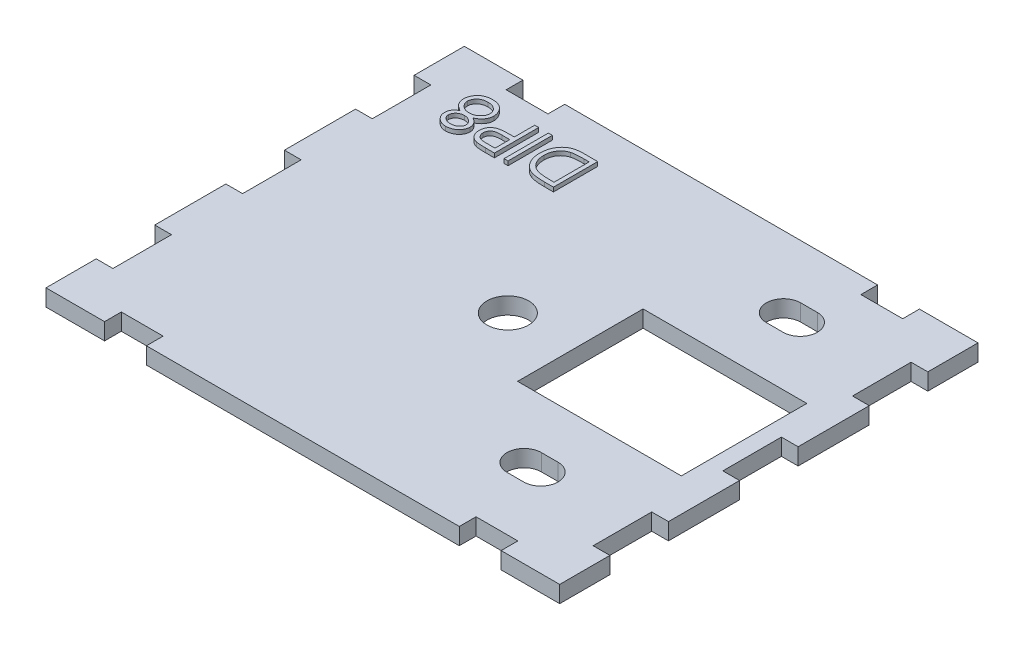
from build123d import *

# Parameters (mm, degrees)
SKETCH2_W           = 100
SKETCH2_H           = 50
BOSS_EXTRUDE1_DEPTH = 2
SKETCH12_W          = 9.8
SKETCH12_H          = 50
SKETCH12_W_2        = 8.8
CUT_EXTRUDE8_DEPTH  = 6
SKETCH13_W          = 2
SKETCH13_H          = 7
SKETCH13_W_2        = 5
SKETCH13_H_2        = 2
CUT_EXTRUDE10_DEPTH = 6
SKETCH15_W          = 6.543059906
SKETCH15_H          = 1
CUT_EXTRUDE13_DEPTH = 10
SKETCH16_R          = 2.5
CUT_EXTRUDE14_DEPTH = 10
SKETCH17_R          = 2.05
CUT_EXTRUDE15_DEPTH = 3.5
SKETCH22_W          = 0.474893163
SKETCH22_H          = 5.291666667
BOSS_EXTRUDE4_DEPTH = 0.5


with BuildPart() as part:
    # Sketch2 → Boss-Extrude1 (new body)
    with BuildSketch(Plane(origin=(0, 0, 0), x_dir=(1, 0, 0), z_dir=(0, 1, 0))):
        Rectangle(SKETCH2_W, SKETCH2_H)
    extrude(amount=BOSS_EXTRUDE1_DEPTH)

    # Sketch12 → Cut-Extrude8 (cut)
    with BuildSketch(Plane(origin=(0, 2, 0), x_dir=(1, 0, 0), z_dir=(0, 1, 0))):
        with Locations((-45.1, 0)):
            Rectangle(SKETCH12_W, SKETCH12_H)
        with Locations((45.6, 0)):
            Rectangle(SKETCH12_W_2, SKETCH12_H)
    extrude(amount=-CUT_EXTRUDE8_DEPTH, mode=Mode.SUBTRACT)

    # Sketch13 → Cut-Extrude10 (cut)
    with BuildSketch(Plane(origin=(0, 2, 0), x_dir=(1, 0, 0), z_dir=(0, 1, 0))):
        with Locations((-29.2, 0)):
            Rectangle(SKETCH13_W, SKETCH13_H)
        Polygon((-30.2, 12), (-30.2, 19), (-30.2, 25), (-40.2, 25), (-40.2, -25), (-30.2, -25), (-30.2, -19), (-30.2, -12), (-30.2, -3.5), (-30.2, 3.5), align=None)
        with Locations((-29.2, 15.5)):
            Rectangle(SKETCH13_W, SKETCH13_H)
        with Locations((21.7, -24)):
            Rectangle(SKETCH13_W_2, SKETCH13_H_2)
        with Locations((30.2, -15.5)):
            Rectangle(SKETCH13_W, SKETCH13_H)
        with Locations((30.2, 0)):
            Rectangle(SKETCH13_W, SKETCH13_H)
        with Locations((30.2, 15.5)):
            Rectangle(SKETCH13_W, SKETCH13_H)
        with Locations((21.7, 24)):
            Rectangle(SKETCH13_W_2, SKETCH13_H_2)
        with Locations((-29.2, -15.5)):
            Rectangle(SKETCH13_W, SKETCH13_H)
        Polygon((41.2, 25), (31.2, 25), (31.2, 19), (31.2, 12), (31.2, 3.5), (31.2, -3.5), (31.2, -12), (31.2, -19), (31.2, -25), (41.2, -25), align=None)
        with Locations((-20.7, 24)):
            Rectangle(SKETCH13_W_2, SKETCH13_H_2)
        with Locations((-20.7, -24)):
            Rectangle(SKETCH13_W_2, SKETCH13_H_2)
    extrude(amount=-CUT_EXTRUDE10_DEPTH, mode=Mode.SUBTRACT)

    # Sketch15 → Cut-Extrude13 (cut)
    with BuildSketch(Plane.XZ):
        Polygon((8.96933351, -7.5), (14.181143059, -7.5), (20.724202965, -7.5), (25.936012514, -7.5), (25.936012514, 5.5), (8.96933351, 5.5), align=None)
        Polygon((27.239237886, -8.5), (20.724202965, -8.5), (20.724202965, -7.5), (25.936012514, -7.5), (25.936012514, 5.5), (8.96933351, 5.5), (8.96933351, -7.5), (14.181143059, -7.5), (14.181143059, -8.5), (7.666108138, -8.5), (7.666108138, 6.5), (27.239237886, 6.5), align=None)
        with Locations((17.452673012, -8)):
            Rectangle(SKETCH15_W, SKETCH15_H)
    extrude(amount=-CUT_EXTRUDE13_DEPTH, mode=Mode.SUBTRACT)

    # Sketch16 → Cut-Extrude14 (cut)
    with BuildSketch(Plane(origin=(0, 0, 0), x_dir=(-1, 0, 0), z_dir=(0, -1, 0))):
        with Locations(Location((0, 0, 0), (0, 0, 90))):
            Circle(SKETCH16_R)
    extrude(amount=-CUT_EXTRUDE14_DEPTH, mode=Mode.SUBTRACT)

    # Sketch17 → Cut-Extrude15 (cut)
    with BuildSketch(Plane(origin=(0, 0, 0), x_dir=(-1, 0, 0), z_dir=(0, -1, 0))):
        with Locations((-18.452672908, -14.5)):
            Circle(SKETCH17_R)
        with Locations((-17.452672908, -14.5)):
            Circle(SKETCH17_R)
        with Locations((-16.452672908, -14.5)):
            Circle(SKETCH17_R)
        with BuildLine():
            ThreePointArc((-16.952672908, -12.511910465), (-16.704582071, -12.46553649), (-16.452672908, -12.45))
            Line((-16.452672908, -12.45), (-17.452672908, -12.45))
            ThreePointArc((-17.452672908, -12.45), (-17.200763745, -12.46553649), (-16.952672908, -12.511910465))
        make_face()
        with BuildLine():
            ThreePointArc((-17.952672908, -12.511910465), (-17.704582071, -12.46553649), (-17.452672908, -12.45))
            Line((-17.452672908, -12.45), (-18.452672908, -12.45))
            ThreePointArc((-18.452672908, -12.45), (-18.200763745, -12.46553649), (-17.952672908, -12.511910465))
        make_face()
        with BuildLine():
            Line((-17.452672856, -16.55), (-16.452672908, -16.55))
            ThreePointArc((-16.452672908, -16.55), (-16.704582071, -16.53446351), (-16.952672908, -16.488089535))
            ThreePointArc((-16.952672908, -16.488089535), (-17.200763719, -16.534463507), (-17.452672856, -16.55))
        make_face()
        with BuildLine():
            ThreePointArc((-17.952672908, -16.488089535), (-18.200763745, -16.53446351), (-18.452672908, -16.55))
            Line((-18.452672908, -16.55), (-17.452672856, -16.55))
            ThreePointArc((-17.452672856, -16.55), (-17.704582045, -16.534463513), (-17.952672908, -16.488089535))
        make_face()
        with Locations((-16.452672903, 16.5)):
            Circle(SKETCH17_R)
        with Locations((-18.452672903, 16.5)):
            Circle(SKETCH17_R)
        with Locations((-17.452672903, 16.5)):
            Circle(SKETCH17_R)
        with BuildLine():
            Line((-17.452672915, 14.45), (-16.452672903, 14.45))
            ThreePointArc((-16.452672903, 14.45), (-16.704582066, 14.46553649), (-16.952672903, 14.511910465))
            ThreePointArc((-16.952672903, 14.511910465), (-17.200763746, 14.465536489), (-17.452672915, 14.45))
        make_face()
        with BuildLine():
            ThreePointArc((-17.952672903, 14.511910465), (-18.20076374, 14.46553649), (-18.452672903, 14.45))
            Line((-18.452672903, 14.45), (-17.452672915, 14.45))
            ThreePointArc((-17.452672915, 14.45), (-17.704582072, 14.465536491), (-17.952672903, 14.511910465))
        make_face()
        with BuildLine():
            ThreePointArc((-17.952672903, 18.488089535), (-17.70458205, 18.534463512), (-17.452672871, 18.55))
            Line((-17.452672871, 18.55), (-18.452672903, 18.55))
            ThreePointArc((-18.452672903, 18.55), (-18.20076374, 18.53446351), (-17.952672903, 18.488089535))
        make_face()
        with BuildLine():
            ThreePointArc((-16.952672903, 18.488089535), (-16.704582066, 18.53446351), (-16.452672903, 18.55))
            Line((-16.452672903, 18.55), (-17.452672871, 18.55))
            ThreePointArc((-17.452672871, 18.55), (-17.200763724, 18.534463508), (-16.952672903, 18.488089535))
        make_face()
    extrude(amount=-CUT_EXTRUDE15_DEPTH, mode=Mode.SUBTRACT)

    # Sketch22 → Boss-Extrude4 (add)
    # profile 1 of 4: a face of its own
    with BuildSketch(Plane(origin=(0, 2, 0), x_dir=(1, 0, 0), z_dir=(0, 1, 0))):
        with BuildLine():
            add(Edge.make_bspline(
                [(-23.289435803, 17.591903377), (-23.332404905, 17.61448406), (-23.416471147, 17.658661691), (-23.536226688, 17.730009944), (-23.647999479, 17.802604298), (-23.749722211, 17.879054809), (-23.842392171, 17.957736407), (-23.926294543, 18.038440897), (-24.002331643, 18.120913039), (-24.067891265, 18.207273039), (-24.126059508, 18.295985161), (-24.175335145, 18.388142762), (-24.218340263, 18.482414147), (-24.252093921, 18.580230551), (-24.279961434, 18.680250068), (-24.299121538, 18.783814795), (-24.309429202, 18.890228595), (-24.31137761, 18.962147422), (-24.312364155, 18.998562365)],
                knots=[0, 0, 0, 0, 1.264219729, 2.473363326, 3.62979159, 4.734286947, 5.785533755, 6.79450939, 7.765315851, 8.704182021, 9.615576613, 10.525715488, 11.423813905, 12.311666436, 13.218214638, 14.126256791, 15.051260205, 16, 16, 16, 16], degree=3))
            add(Edge.make_bspline(
                [(-24.312364155, 18.998562365), (-24.311204378, 19.049512323), (-24.308908743, 19.150361407), (-24.288705392, 19.299170633), (-24.258862371, 19.444279836), (-24.213527962, 19.584044036), (-24.15774182, 19.719654049), (-24.087347083, 19.849282845), (-24.007897509, 19.976651469), (-23.944003353, 20.054992402), (-23.911673049, 20.094632744)],
                knots=[0, 0, 0, 0, 1.02531512, 2.029483338, 3.018748588, 4.004195107, 4.983200899, 5.966616707, 6.971112471, 8, 8, 8, 8], degree=3))
            add(Edge.make_bspline(
                [(-23.911673049, 20.094632744), (-23.869586951, 20.140887617), (-23.785934825, 20.232825779), (-23.642632065, 20.352191884), (-23.485360884, 20.452505849), (-23.314729833, 20.534257404), (-23.131195025, 20.597887215), (-22.934795566, 20.643611021), (-22.725148573, 20.669800885), (-22.581055777, 20.673586679), (-22.50713412, 20.675528845)],
                knots=[0, 0, 0, 0, 0.954267603, 1.896743057, 2.838368354, 3.796610408, 4.779680527, 5.799409237, 6.871065594, 8, 8, 8, 8], degree=3))
            add(Edge.make_bspline(
                [(-22.50713412, 20.675528845), (-22.436055991, 20.673781732), (-22.297745171, 20.670382028), (-22.096400606, 20.64747387), (-21.908487986, 20.606917675), (-21.733116378, 20.552556064), (-21.57198157, 20.480063565), (-21.424790588, 20.391208922), (-21.289386079, 20.287998182), (-21.170015852, 20.167947464), (-21.064068193, 20.039336519), (-20.970919412, 19.906693561), (-20.893932238, 19.770115131), (-20.827575478, 19.631678729), (-20.778193171, 19.488579337), (-20.743167977, 19.342285484), (-20.72116727, 19.193212775), (-20.718224786, 19.09262613), (-20.716744497, 19.04202357)],
                knots=[0, 0, 0, 0, 1.256864279, 2.445730223, 3.576845088, 4.651810441, 5.686528262, 6.692706664, 7.686234615, 8.689148594, 9.678739427, 10.630299996, 11.55097961, 12.448208961, 13.341360817, 14.221834469, 15.105450545, 16, 16, 16, 16], degree=3))
            add(Edge.make_bspline(
                [(-20.716744497, 19.04202357), (-20.717618412, 19.004892494), (-20.719345576, 18.931508382), (-20.731293861, 18.823089499), (-20.750519307, 18.717568868), (-20.776571554, 18.61452999), (-20.812202555, 18.514516547), (-20.854473631, 18.417012756), (-20.904236832, 18.322021441), (-20.963451698, 18.230988823), (-21.028691128, 18.140690304), (-21.106136334, 18.055609622), (-21.190624087, 17.970749255), (-21.287183971, 17.891269556), (-21.390601042, 17.810604383), (-21.505698429, 17.735495922), (-21.628638317, 17.660082318), (-21.716038773, 17.615019626), (-21.760873437, 17.591903377)],
                knots=[0, 0, 0, 0, 0.941575622, 1.860885767, 2.762557628, 3.660168386, 4.552890429, 5.45184204, 6.353736508, 7.268493418, 8.204037487, 9.175167802, 10.182660057, 11.238220596, 12.344046335, 13.507168087, 14.721227736, 16, 16, 16, 16], degree=3))
            add(Edge.make_bspline(
                [(-21.760873437, 17.591903377), (-21.699577858, 17.558340511), (-21.581078052, 17.493455028), (-21.422672491, 17.375729424), (-21.288489585, 17.245915039), (-21.179955341, 17.103816516), (-21.09426206, 16.95410414), (-21.033675933, 16.797566068), (-20.994129984, 16.635948219), (-20.990123942, 16.52574089), (-20.988112018, 16.470392293)],
                knots=[0, 0, 0, 0, 1.16701039, 2.256125286, 3.287752239, 4.277689688, 5.235169525, 6.160862735, 7.076343936, 8, 8, 8, 8], degree=3))
            add(Edge.make_bspline(
                [(-20.988112018, 16.470392293), (-20.99058901, 16.414004539), (-20.995568195, 16.30065532), (-21.035692113, 16.131877426), (-21.101573472, 15.966019636), (-21.18964704, 15.803466302), (-21.301731542, 15.651624337), (-21.434399213, 15.514337341), (-21.587483171, 15.395158449), (-21.757618679, 15.294413112), (-21.940381157, 15.212025645), (-22.133537089, 15.155780959), (-22.333643963, 15.118788779), (-22.46986568, 15.114612288), (-22.538935002, 15.112494657)],
                knots=[0, 0, 0, 0, 0.888724595, 1.786491426, 2.720083884, 3.697804067, 4.69440576, 5.687697823, 6.7000873, 7.744853364, 8.800284131, 9.853047784, 10.91141782, 12, 12, 12, 12], degree=3))
            add(Edge.make_bspline(
                [(-22.538935002, 15.112494657), (-22.606223043, 15.114671942), (-22.738907394, 15.1189653), (-22.934231025, 15.155126734), (-23.121279065, 15.21484513), (-23.299003181, 15.296181802), (-23.463621786, 15.397529675), (-23.610117107, 15.518020117), (-23.739685062, 15.65381121), (-23.846731579, 15.806153981), (-23.932605497, 15.968696476), (-23.994444609, 16.137306704), (-24.0335398, 16.30996329), (-24.038507636, 16.426729958), (-24.040996634, 16.485232704)],
                knots=[0, 0, 0, 0, 1.072634126, 2.115112298, 3.156050586, 4.19761425, 5.225177188, 6.230426315, 7.215180151, 8.209739481, 9.190420596, 10.139012357, 11.067603024, 12, 12, 12, 12], degree=3))
            add(Edge.make_bspline(
                [(-24.040996634, 16.485232704), (-24.038814594, 16.542644763), (-24.034529192, 16.655398782), (-23.998954414, 16.819531188), (-23.938110498, 16.972926268), (-23.856031863, 17.11794444), (-23.748301785, 17.252268321), (-23.617095434, 17.376565011), (-23.464115364, 17.493265493), (-23.348963868, 17.558289128), (-23.289435803, 17.591903377)],
                knots=[0, 0, 0, 0, 0.975463758, 1.915755378, 2.838359076, 3.772025586, 4.738400888, 5.753889765, 6.838863581, 8, 8, 8, 8], degree=3))
        make_face()
        with BuildLine():
            add(Edge.make_bspline(
                [(-22.512434267, 15.655229699), (-22.47531449, 15.656211427), (-22.402691974, 15.658132116), (-22.296228701, 15.668244), (-22.194907486, 15.687667345), (-22.098174266, 15.714277066), (-22.005697671, 15.747384889), (-21.919598353, 15.791005575), (-21.836982884, 15.839490149), (-21.760561541, 15.896360348), (-21.691380821, 15.958406963), (-21.629590243, 16.023204881), (-21.579250098, 16.092664313), (-21.535940626, 16.163310298), (-21.503777294, 16.238073053), (-21.480929572, 16.315315625), (-21.464760061, 16.395527264), (-21.463594687, 16.45017091), (-21.463005181, 16.477812499)],
                knots=[0, 0, 0, 0, 1.20353747, 2.354645537, 3.462130888, 4.543058862, 5.604822423, 6.639552563, 7.666902586, 8.706944258, 9.720926464, 10.677177239, 11.602682187, 12.496457588, 13.358248655, 14.231532794, 15.105417644, 16, 16, 16, 16], degree=3))
            add(Edge.make_bspline(
                [(-21.463005181, 16.477812499), (-21.464080303, 16.505438436), (-21.466204899, 16.560031256), (-21.481582796, 16.640972731), (-21.507294769, 16.719478164), (-21.542551413, 16.796280423), (-21.587796714, 16.871182371), (-21.642711, 16.944471028), (-21.709676985, 17.014208335), (-21.78362764, 17.082372873), (-21.864405646, 17.14517387), (-21.949288635, 17.201271158), (-22.03889609, 17.245991422), (-22.130544476, 17.285201955), (-22.226171939, 17.314614401), (-22.32511912, 17.335804335), (-22.427280324, 17.348911631), (-22.496495028, 17.350482111), (-22.531514796, 17.351276708)],
                knots=[0, 0, 0, 0, 0.873213166, 1.72559466, 2.594724523, 3.479581045, 4.391597569, 5.35687048, 6.368548091, 7.443976143, 8.534559525, 9.600545123, 10.654815915, 11.696401765, 12.749428718, 13.812189468, 14.893058657, 16, 16, 16, 16], degree=3))
            add(Edge.make_bspline(
                [(-22.531514796, 17.351276708), (-22.576496813, 17.349963671), (-22.666016561, 17.347350566), (-22.797934775, 17.322833119), (-22.926524557, 17.284755207), (-23.049352767, 17.230710492), (-23.164221069, 17.164816998), (-23.267889704, 17.087110128), (-23.356020332, 16.995764996), (-23.430997068, 16.896080311), (-23.489618261, 16.790338942), (-23.534523013, 16.683790582), (-23.560967949, 16.575557598), (-23.564405573, 16.503033178), (-23.566103471, 16.467212205)],
                knots=[0, 0, 0, 0, 1.076561449, 2.142489767, 3.202892658, 4.283174188, 5.348766409, 6.369549039, 7.375093932, 8.378927502, 9.349008457, 10.26378795, 11.142457041, 12, 12, 12, 12], degree=3))
            add(Edge.make_bspline(
                [(-23.566103471, 16.467212205), (-23.565314167, 16.442066926), (-23.563747511, 16.392157152), (-23.550314376, 16.318212536), (-23.529362787, 16.245904034), (-23.498822884, 16.175656129), (-23.46187911, 16.1058369), (-23.414787797, 16.03863664), (-23.360211652, 15.972021681), (-23.297362791, 15.908184689), (-23.22635654, 15.848252806), (-23.146618515, 15.796301252), (-23.058852377, 15.752979436), (-22.964234769, 15.716583757), (-22.861765786, 15.689552381), (-22.752327664, 15.669210289), (-22.634932936, 15.65776836), (-22.554152771, 15.656094273), (-22.512434267, 15.655229699)],
                knots=[0, 0, 0, 0, 0.814035228, 1.61574325, 2.427118093, 3.24780647, 4.092880925, 4.981933388, 5.900917883, 6.880367106, 7.87994501, 8.905470125, 9.95492938, 11.0455354, 12.184050453, 13.382997595, 14.64846247, 16, 16, 16, 16], degree=3))
        make_face(mode=Mode.SUBTRACT)
        with BuildLine():
            add(Edge.make_bspline(
                [(-22.543175119, 17.894011751), (-22.496116025, 17.894849043), (-22.403797565, 17.896491606), (-22.268545382, 17.914766395), (-22.138750223, 17.940223154), (-22.014810536, 17.978778768), (-21.897362521, 18.028944861), (-21.784753311, 18.088433254), (-21.678746335, 18.159735969), (-21.579815409, 18.241123996), (-21.489241489, 18.329322244), (-21.409489888, 18.422471375), (-21.342111092, 18.519306541), (-21.287432444, 18.619950223), (-21.245014196, 18.724180672), (-21.213708873, 18.832058714), (-21.195533045, 18.943885259), (-21.192943361, 19.019699148), (-21.191637659, 19.05792401)],
                knots=[0, 0, 0, 0, 1.140332253, 2.237053636, 3.304055028, 4.344690294, 5.377465719, 6.397042765, 7.428360044, 8.469453732, 9.499453352, 10.490108612, 11.438398528, 12.354680514, 13.261581007, 14.161901135, 15.073242693, 16, 16, 16, 16], degree=3))
            add(Edge.make_bspline(
                [(-21.191637659, 19.05792401), (-21.193736865, 19.105436245), (-21.197916883, 19.200044447), (-21.229889104, 19.339513735), (-21.282396734, 19.474495236), (-21.356058748, 19.603085246), (-21.445909182, 19.723724669), (-21.555139911, 19.83036229), (-21.681087775, 19.921562602), (-21.822718051, 19.997787354), (-21.977972565, 20.058158391), (-22.145891871, 20.101349747), (-22.325338543, 20.12849734), (-22.449086216, 20.131339079), (-22.512434267, 20.132793802)],
                knots=[0, 0, 0, 0, 0.899105568, 1.790333855, 2.694925079, 3.632758987, 4.588257081, 5.534574046, 6.511571685, 7.523527334, 8.572244311, 9.657983075, 10.801090915, 12, 12, 12, 12], degree=3))
            add(Edge.make_bspline(
                [(-22.512434267, 20.132793802), (-22.561946272, 20.131832001), (-22.658411534, 20.129958104), (-22.79919616, 20.113761674), (-22.931741394, 20.087305183), (-23.05731706, 20.051433018), (-23.174988471, 20.00388132), (-23.284595238, 19.944817552), (-23.387629904, 19.877353963), (-23.479688966, 19.797482909), (-23.563393287, 19.71201594), (-23.636711674, 19.622016397), (-23.698761577, 19.528385631), (-23.74877976, 19.431178451), (-23.788498975, 19.330752085), (-23.817132006, 19.226694282), (-23.834779351, 19.118596315), (-23.836565569, 19.045270882), (-23.837470993, 19.00810263)],
                knots=[0, 0, 0, 0, 1.224631902, 2.385975653, 3.500340538, 4.565441647, 5.612488581, 6.63322211, 7.641830068, 8.652595074, 9.641693811, 10.598750962, 11.520088299, 12.415429315, 13.298523938, 14.187139574, 15.081071174, 16, 16, 16, 16], degree=3))
            add(Edge.make_bspline(
                [(-23.837470993, 19.00810263), (-23.836110484, 18.971998254), (-23.833427799, 18.900806732), (-23.816156573, 18.795386006), (-23.786507588, 18.69311897), (-23.743274369, 18.594466875), (-23.69018178, 18.49828214), (-23.624595492, 18.40537225), (-23.547314869, 18.315479941), (-23.45852907, 18.230455999), (-23.362305315, 18.151855224), (-23.260329144, 18.082004429), (-23.152135819, 18.024914734), (-23.039868607, 17.976955371), (-22.922395756, 17.939580332), (-22.800283876, 17.913372465), (-22.673301633, 17.896900838), (-22.587040661, 17.89498566), (-22.543175119, 17.894011751)],
                knots=[0, 0, 0, 0, 0.917336384, 1.808827106, 2.706624561, 3.615530867, 4.539869921, 5.493819324, 6.499753197, 7.547410123, 8.613069608, 9.653934021, 10.682176708, 11.716048074, 12.752411263, 13.808993382, 14.885826486, 16, 16, 16, 16], degree=3))
        make_face(mode=Mode.SUBTRACT)
    # profile 2 of 4: a face of its own
    with BuildSketch(Plane(origin=(0, 2, 0), x_dir=(1, 0, 0), z_dir=(0, 1, 0))):
        with BuildLine():
            Line((-16.849757317, 15.248178417), (-17.887526081, 15.248178417))
            add(Edge.make_bspline(
                [(-17.887526081, 15.248178417), (-17.958904475, 15.24825688), (-18.095668647, 15.248407217), (-18.291785458, 15.252965225), (-18.469902552, 15.2590532), (-18.629635866, 15.267492491), (-18.771476871, 15.277465907), (-18.894783741, 15.29145411), (-19.000525689, 15.306059556), (-19.06388425, 15.320908588), (-19.092779486, 15.327680621)],
                knots=[0, 0, 0, 0, 1.415646017, 2.712440637, 3.8905458, 4.950247383, 5.884950622, 6.709939814, 7.411656543, 8, 8, 8, 8], degree=3))
            add(Edge.make_bspline(
                [(-19.092779486, 15.327680621), (-19.129357573, 15.337692681), (-19.201651829, 15.357480878), (-19.305827007, 15.39710916), (-19.404925695, 15.44411866), (-19.499362415, 15.497616299), (-19.587519359, 15.560128491), (-19.672148956, 15.628047242), (-19.7514764, 15.704119349), (-19.824303874, 15.788244656), (-19.891781673, 15.877667251), (-19.948265428, 15.974667362), (-19.998142805, 16.075880016), (-20.0370127, 16.18377635), (-20.06756593, 16.296932148), (-20.089817881, 16.415641918), (-20.104119685, 16.539649576), (-20.105476746, 16.624409671), (-20.106167574, 16.667557758)],
                knots=[0, 0, 0, 0, 0.999333726, 1.975119402, 2.933498163, 3.889020618, 4.832249799, 5.779334906, 6.747801194, 7.724875447, 8.710438469, 9.696133548, 10.679360639, 11.681339199, 12.714023775, 13.766351759, 14.862936069, 16, 16, 16, 16], degree=3))
            add(Edge.make_bspline(
                [(-20.106167574, 16.667557758), (-20.10553042, 16.711067015), (-20.104283785, 16.796195817), (-20.089321544, 16.920735628), (-20.069167564, 17.039750337), (-20.038177973, 17.152976053), (-19.997589872, 17.259740373), (-19.949976887, 17.361674855), (-19.892549407, 17.457045311), (-19.826562581, 17.546197977), (-19.753157194, 17.629216535), (-19.672643823, 17.705499379), (-19.585347512, 17.774599986), (-19.491545693, 17.836673267), (-19.390323898, 17.890279785), (-19.283217308, 17.938293806), (-19.169294957, 17.978617909), (-19.090460442, 17.999830026), (-19.050378311, 18.010614983)],
                knots=[0, 0, 0, 0, 1.121902311, 2.195077645, 3.232258892, 4.234102512, 5.217864754, 6.176164875, 7.132989551, 8.084763148, 9.034132444, 9.988522005, 10.94243251, 11.903244335, 12.886203696, 13.894208494, 14.929344452, 16, 16, 16, 16], degree=3))
            add(Edge.make_bspline(
                [(-19.050378311, 18.010614983), (-19.017225893, 18.017659712), (-18.944570441, 18.033098645), (-18.824921685, 18.050451574), (-18.685544292, 18.064682872), (-18.526912485, 18.077963633), (-18.348656338, 18.085000776), (-18.151184687, 18.09326353), (-17.933829219, 18.097162272), (-17.782230557, 18.097408721), (-17.703080969, 18.097537392)],
                knots=[0, 0, 0, 0, 0.601372724, 1.317943291, 2.144091499, 3.08771165, 4.142394186, 5.309582461, 6.595334295, 8, 8, 8, 8], degree=3))
            Line((-17.703080969, 18.097537392), (-17.32465048, 18.097537392))
            Line((-17.32465048, 18.097537392), (-17.32465048, 20.539845084))
            Line((-17.32465048, 20.539845084), (-16.849757317, 20.539845084))
            Line((-16.849757317, 20.539845084), (-16.849757317, 15.248178417))
        make_face()
        with BuildLine():
            Line((-17.32465048, 15.79091346), (-17.32465048, 17.554802349))
            Line((-17.32465048, 17.554802349), (-18.251116158, 17.566462672))
            add(Edge.make_bspline(
                [(-18.251116158, 17.566462672), (-18.296352998, 17.5664925), (-18.383681785, 17.566550082), (-18.510171515, 17.560421484), (-18.627242279, 17.553754261), (-18.735066925, 17.542971778), (-18.833153313, 17.529820509), (-18.921738923, 17.512237197), (-19.001530711, 17.494303354), (-19.093442015, 17.463184955), (-19.196392314, 17.4162389), (-19.308129847, 17.346119114), (-19.403600406, 17.257785816), (-19.485518732, 17.157394105), (-19.550269573, 17.045594913), (-19.597197314, 16.926308405), (-19.625841034, 16.799987531), (-19.629441306, 16.713641524), (-19.631274411, 16.669677816)],
                knots=[0, 0, 0, 0, 1.160501667, 2.240324542, 3.248665471, 4.168823117, 5.020172044, 5.786515869, 6.485785279, 7.116517804, 8.272762037, 9.381837012, 10.485674779, 11.594342068, 12.695271952, 13.786226926, 14.872841088, 16, 16, 16, 16], degree=3))
            add(Edge.make_bspline(
                [(-19.631274411, 16.669677816), (-19.629359524, 16.627138412), (-19.625552964, 16.54257534), (-19.597433922, 16.418581872), (-19.549772594, 16.300651465), (-19.485465943, 16.189738386), (-19.405510669, 16.089613502), (-19.311938821, 16.003248829), (-19.206206234, 15.933346739), (-19.108619451, 15.886813583), (-19.021286965, 15.859525505), (-18.945795973, 15.839824894), (-18.860125246, 15.826237802), (-18.765085548, 15.81323751), (-18.660798562, 15.802743445), (-18.546601151, 15.795456031), (-18.422873698, 15.791235826), (-18.336981928, 15.791023517), (-18.292457304, 15.79091346)],
                knots=[0, 0, 0, 0, 1.12039168, 2.227199994, 3.330242575, 4.460839274, 5.593542475, 6.693949254, 7.801736126, 8.92216649, 9.528704869, 10.210659466, 10.975987387, 11.81211542, 12.738540127, 13.736887663, 14.826846554, 16, 16, 16, 16], degree=3))
            Line((-18.292457304, 15.79091346), (-17.32465048, 15.79091346))
        make_face(mode=Mode.SUBTRACT)
    # profile 3 of 4: a face of its own
    with BuildSketch(Plane(origin=(0, 2, 0), x_dir=(1, 0, 0), z_dir=(0, 1, 0))):
        with Locations((-15.458998771, 17.89401175)):
            Rectangle(SKETCH22_W, SKETCH22_H)
    # profile 4 of 4: a face of its own
    with BuildSketch(Plane(origin=(0, 2, 0), x_dir=(1, 0, 0), z_dir=(0, 1, 0))):
        with BuildLine():
            Line((-9.794201762, 20.539845084), (-9.794201762, 15.248178417))
            Line((-9.794201762, 15.248178417), (-10.862711377, 15.248178417))
            add(Edge.make_bspline(
                [(-10.862711377, 15.248178417), (-10.955646826, 15.248845718), (-11.135197631, 15.250134939), (-11.394656719, 15.258355989), (-11.634380243, 15.272752196), (-11.854232067, 15.294126465), (-12.054565401, 15.319781578), (-12.235059386, 15.352408477), (-12.396006529, 15.39077992), (-12.494989894, 15.423507319), (-12.541797916, 15.438983706)],
                knots=[0, 0, 0, 0, 1.314317071, 2.539253741, 3.67075822, 4.709970291, 5.662644612, 6.526156501, 7.303037452, 8, 8, 8, 8], degree=3))
            add(Edge.make_bspline(
                [(-12.541797916, 15.438983706), (-12.60302758, 15.462306224), (-12.724098423, 15.508422383), (-12.896386852, 15.595547119), (-13.059127226, 15.693859614), (-13.211034541, 15.805613833), (-13.352443516, 15.929381688), (-13.485133382, 16.064161799), (-13.605300833, 16.21355234), (-13.717090477, 16.372917778), (-13.814935421, 16.543708371), (-13.901215858, 16.722503207), (-13.974886252, 16.908955371), (-14.032368948, 17.104425318), (-14.079859589, 17.307035637), (-14.111724644, 17.518320336), (-14.132891318, 17.737047608), (-14.135008075, 17.885479957), (-14.136082104, 17.960793602)],
                knots=[0, 0, 0, 0, 0.984696416, 1.947063185, 2.89840987, 3.841051395, 4.778753227, 5.721858861, 6.681155121, 7.65838316, 8.646299769, 9.637283673, 10.641736726, 11.657050558, 12.698485921, 13.768600492, 14.86780186, 16, 16, 16, 16], degree=3))
            add(Edge.make_bspline(
                [(-14.136082104, 17.960793602), (-14.135130523, 18.026200252), (-14.133255335, 18.155090889), (-14.116438052, 18.345051132), (-14.09194744, 18.529361241), (-14.054204692, 18.707211928), (-14.007827279, 18.879800613), (-13.950585726, 19.046310112), (-13.882739951, 19.206853596), (-13.804058122, 19.360155912), (-13.71790473, 19.505844287), (-13.624026466, 19.641610381), (-13.525637661, 19.768951073), (-13.4191499, 19.884989597), (-13.308088882, 19.993339426), (-13.188677268, 20.089194152), (-13.064653977, 20.177003811), (-12.932292989, 20.254101774), (-12.790508332, 20.322682703), (-12.63559639, 20.38059971), (-12.468122548, 20.430441608), (-12.286977089, 20.470152222), (-12.092764151, 20.502160991), (-11.884957268, 20.523477188), (-11.66394557, 20.53793223), (-11.512181182, 20.539195085), (-11.434067213, 20.539845084)],
                knots=[0, 0, 0, 0, 1.105894396, 2.179280415, 3.222964075, 4.248423888, 5.251546139, 6.243661943, 7.223682738, 8.196462441, 9.155694589, 10.083899862, 10.986397372, 11.874737962, 12.745335529, 13.607670254, 14.461432187, 15.313100333, 16.195087267, 17.121790994, 18.106827133, 19.14775296, 20.255889161, 21.433815148, 22.679170477, 24, 24, 24, 24], degree=3))
            Line((-11.434067213, 20.539845084), (-9.794201762, 20.539845084))
        make_face()
        with BuildLine():
            Line((-10.269094924, 19.997110041), (-10.876491759, 19.997110041))
            add(Edge.make_bspline(
                [(-10.876491759, 19.997110041), (-10.963771558, 19.996734943), (-11.131642575, 19.996013492), (-11.373030261, 19.98968284), (-11.593586015, 19.979338482), (-11.793341154, 19.964861876), (-11.972182893, 19.945708137), (-12.130484991, 19.924352629), (-12.267728537, 19.897746959), (-12.350776614, 19.873630628), (-12.389153685, 19.86248631)],
                knots=[0, 0, 0, 0, 1.375205317, 2.645023457, 3.804390687, 4.853969522, 5.800190428, 6.637939096, 7.370582563, 8, 8, 8, 8], degree=3))
            add(Edge.make_bspline(
                [(-12.389153685, 19.86248631), (-12.437457592, 19.845476297), (-12.532911669, 19.811862553), (-12.670300372, 19.750524854), (-12.798499649, 19.677957626), (-12.919646715, 19.596817328), (-13.032962998, 19.505851075), (-13.137923739, 19.404769574), (-13.235357997, 19.294743066), (-13.323705759, 19.175400814), (-13.4036093, 19.048066979), (-13.472645697, 18.912883401), (-13.530842597, 18.770608682), (-13.578589285, 18.62173782), (-13.61581533, 18.466182211), (-13.64202393, 18.30355149), (-13.658265092, 18.133909881), (-13.660203698, 18.018425372), (-13.661188941, 17.959733572)],
                knots=[0, 0, 0, 0, 0.998420628, 1.972994, 2.929372424, 3.86770908, 4.81360496, 5.759023883, 6.706048443, 7.676227424, 8.651287839, 9.634325482, 10.632389399, 11.645655052, 12.680158286, 13.74837235, 14.855672678, 16, 16, 16, 16], degree=3))
            add(Edge.make_bspline(
                [(-13.661188941, 17.959733572), (-13.660412073, 17.897846419), (-13.658885907, 17.776268559), (-13.639735283, 17.597872612), (-13.611689968, 17.426319709), (-13.571348971, 17.261486341), (-13.519231881, 17.103586959), (-13.456869559, 16.951729499), (-13.38115191, 16.807868222), (-13.295431527, 16.670784678), (-13.199194698, 16.542554911), (-13.092868326, 16.4246812), (-12.977573557, 16.316943975), (-12.85384175, 16.219171701), (-12.719942925, 16.133103123), (-12.578142913, 16.05653786), (-12.426444272, 15.991483459), (-12.320892138, 15.956895335), (-12.267250306, 15.939317573)],
                knots=[0, 0, 0, 0, 1.122272916, 2.204715076, 3.251197285, 4.274229216, 5.279697671, 6.265416158, 7.248880903, 8.225321784, 9.195852973, 10.153576302, 11.101466393, 12.055578741, 13.010401466, 13.985536859, 14.976245305, 16, 16, 16, 16], degree=3))
            add(Edge.make_bspline(
                [(-12.267250306, 15.939317573), (-12.222874168, 15.927046307), (-12.128518323, 15.900954229), (-11.974546753, 15.872492059), (-11.801259563, 15.847387638), (-11.607887395, 15.826133221), (-11.394650678, 15.810882152), (-11.161385411, 15.799435045), (-10.907990771, 15.791714303), (-10.732333845, 15.791187091), (-10.641165237, 15.79091346)],
                knots=[0, 0, 0, 0, 0.674548936, 1.434276114, 2.292660221, 3.240891867, 4.284742987, 5.42552168, 6.663806718, 8, 8, 8, 8], degree=3))
            Line((-10.641165237, 15.79091346), (-10.269094924, 15.79091346))
            Line((-10.269094924, 15.79091346), (-10.269094924, 19.997110041))
        make_face(mode=Mode.SUBTRACT)
    extrude(amount=BOSS_EXTRUDE4_DEPTH)


solid = part.part
